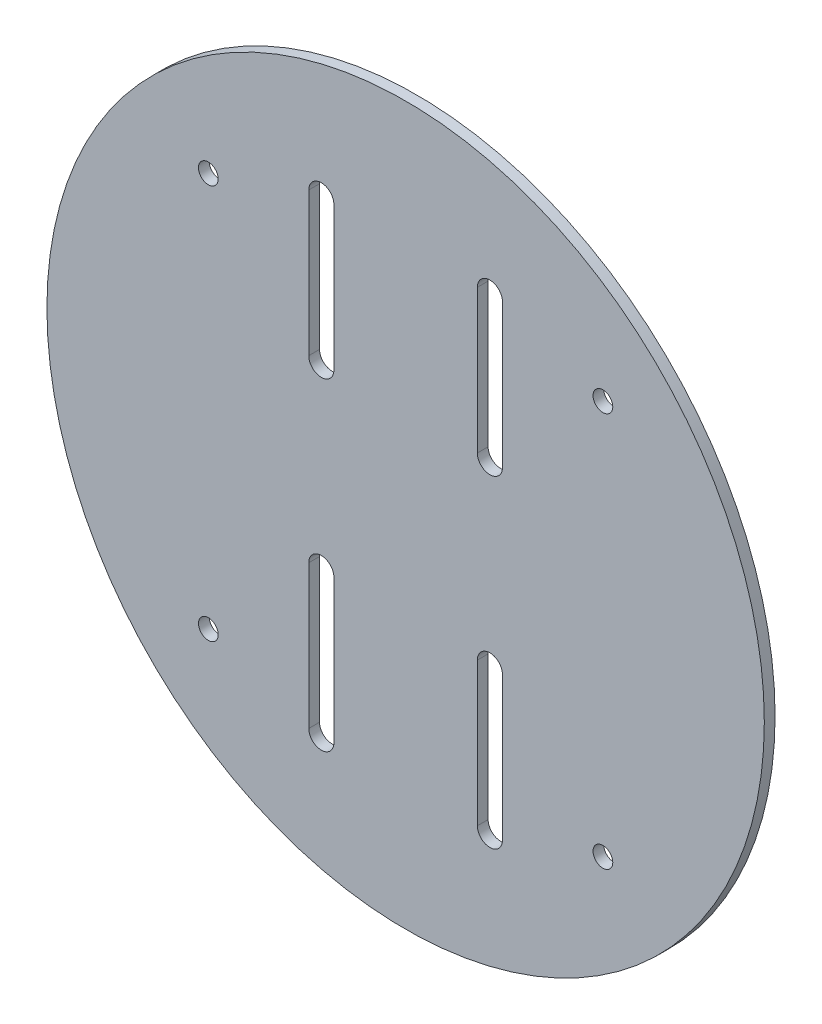
from build123d import *

# Parameters (mm, degrees)
IZIM1_R                     = 100
Y_KSEKLIK_EKSTR_ZYON1_DEPTH = 30
KES_EKSTR_ZYON1_DEPTH       = 145.568322948
M5_BO_LUKLU_DELIK2_D        = 5.5
IZIM20_R                    = 183.537558205
KES_EKSTR_ZYON3_DEPTH       = 27


with BuildPart() as part:
    # Çizim1 → Yükseklik-Ekstrüzyon1 (new body)
    with BuildSketch(Plane.XY):
        Circle(IZIM1_R)
    extrude(amount=Y_KSEKLIK_EKSTR_ZYON1_DEPTH)

    # Çizim9 → Kes-Ekstrüzyon1 (cut, through all)
    with BuildSketch(Plane.XY.offset(30)):
        with BuildLine():
            Line((27, 65), (27, 25))
            ThreePointArc((27, 25), (23.5, 21.5), (20, 25))
            Line((20, 25), (20, 65))
            ThreePointArc((20, 65), (23.5, 68.5), (27, 65))
        make_face()
        with BuildLine():
            Line((-20, 65), (-20, 25))
            ThreePointArc((-20, 25), (-23.5, 21.5), (-27, 25))
            Line((-27, 25), (-27, 65))
            ThreePointArc((-27, 65), (-23.5, 68.5), (-20, 65))
        make_face()
        with BuildLine():
            Line((-20, -25), (-20, -65))
            ThreePointArc((-20, -65), (-23.5, -68.5), (-27, -65))
            Line((-27, -65), (-27, -25))
            ThreePointArc((-27, -25), (-23.5, -21.5), (-20, -25))
        make_face()
        with BuildLine():
            Line((20, -65), (20, -25))
            ThreePointArc((20, -25), (23.5, -21.5), (27, -25))
            Line((27, -25), (27, -65))
            ThreePointArc((27, -65), (23.5, -68.5), (20, -65))
        make_face()
    extrude(amount=-KES_EKSTR_ZYON1_DEPTH, mode=Mode.SUBTRACT)

    # M5 Boşluklu Delik2 (through all)
    with Locations(Plane.XY.offset(30)):
        with Locations((-55, 55), (55, 55), (55, -55), (-55, -55)):
            Hole(M5_BO_LUKLU_DELIK2_D / 2)

    # Çizim20 → Kes-Ekstrüzyon3 (cut)
    with BuildSketch(Plane.XY.offset(30)):
        with Locations((0, 8.479468632)):
            Circle(IZIM20_R)
    extrude(amount=-KES_EKSTR_ZYON3_DEPTH, mode=Mode.SUBTRACT)


solid = part.part
